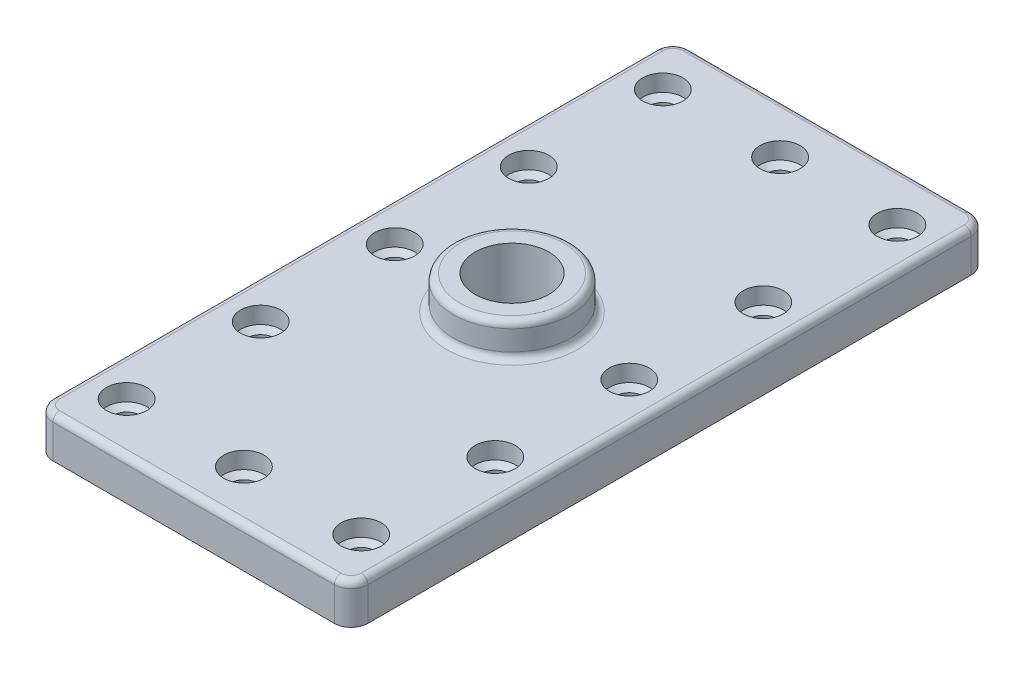
from build123d import *

# Parameters (mm, degrees)
SKETCH1_W            = 94
SKETCH1_H            = 190
PLATE_DEPTH          = 12
SKETCH2_R            = 17.5
BOSS_DEPTH           = 10
SKETCH3_R            = 11
CENTER_HOLE_DEPTH    = 109.249711316
FILLET_R5_R          = 5
FILLET_R2_R          = 2
LPATTERN1_COUNT      = 5
LPATTERN1_PITCH      = 40
LPATTERN1_COUNT_DIR2 = 3
LPATTERN1_PITCH_DIR2 = 35


with BuildPart() as part:
    # Sketch1 → plate (new body)
    with BuildSketch(Plane(origin=(0, 0, 0), x_dir=(1, 0, 0), z_dir=(0, 1, 0))):
        Rectangle(SKETCH1_W, SKETCH1_H)
    extrude(amount=PLATE_DEPTH)

    # Sketch2 → boss (add)
    with BuildSketch(Plane(origin=(0, 12, 0), x_dir=(-1, 0, 0), z_dir=(0, 1, 0))):
        with Locations(Location((0, 0, 0), (0, 0, 270))):
            Circle(SKETCH2_R)
    extrude(amount=BOSS_DEPTH)

    # Sketch3 → center hole (cut, through all)
    with BuildSketch(Plane(origin=(0, 22, 0), x_dir=(-1, 0, 0), z_dir=(0, 1, 0))):
        with Locations(Location((0, 0, 0), (0, 0, 90))):
            Circle(SKETCH3_R)
    extrude(amount=-CENTER_HOLE_DEPTH, mode=Mode.SUBTRACT)

    # Sketch4 → pattern hole (revolve, cut)
    with BuildSketch(Plane(origin=(-35, 12, 80), x_dir=(0, 0, 1), z_dir=(1, 0, 0))):
        Polygon((0, 0), (0, 12), (4, 12), (4, 6.201721238), (6, 5), (6, 0), align=None)
    pattern_hole = revolve(axis=Axis((-35, 18.130023899, 80), (0, -1, 0)), mode=Mode.SUBTRACT)

    # Fillet R5
    fillet_r5_edges = [part.edges().sort_by_distance(p)[0] for p in [
        (-47, 6, -95),
        (47, 6, -95),
        (47, 6, 95),
        (-47, 6, 95),
    ]]
    fillet(fillet_r5_edges, radius=FILLET_R5_R)

    # Fillet R2
    fillet_r2_edges = [part.edges().sort_by_distance(p)[0] for p in [
        (0, 12, 17.5),
        (0, 22, 17.5),
        (47, 12, 0),
        (0, 12, 95),
        (-47, 12, 0),
        (0, 12, -95),
        (45.535533906, 12, -93.535533906),
        (-45.535533906, 12, -93.535533906),
        (-45.535533906, 12, 93.535533906),
        (45.535533906, 12, 93.535533906),
    ]]
    fillet(fillet_r2_edges, radius=FILLET_R2_R)

    # LPattern1: pattern hole 5 × 3, 3 skipped
    with Locations(*[(j * LPATTERN1_PITCH_DIR2, 0, -i * LPATTERN1_PITCH) for i in range(LPATTERN1_COUNT) for j in range(LPATTERN1_COUNT_DIR2) if (i, j) not in ((0, 0), (1, 1), (2, 1), (3, 1))]):
        add(pattern_hole, mode=Mode.SUBTRACT)


solid = part.part
